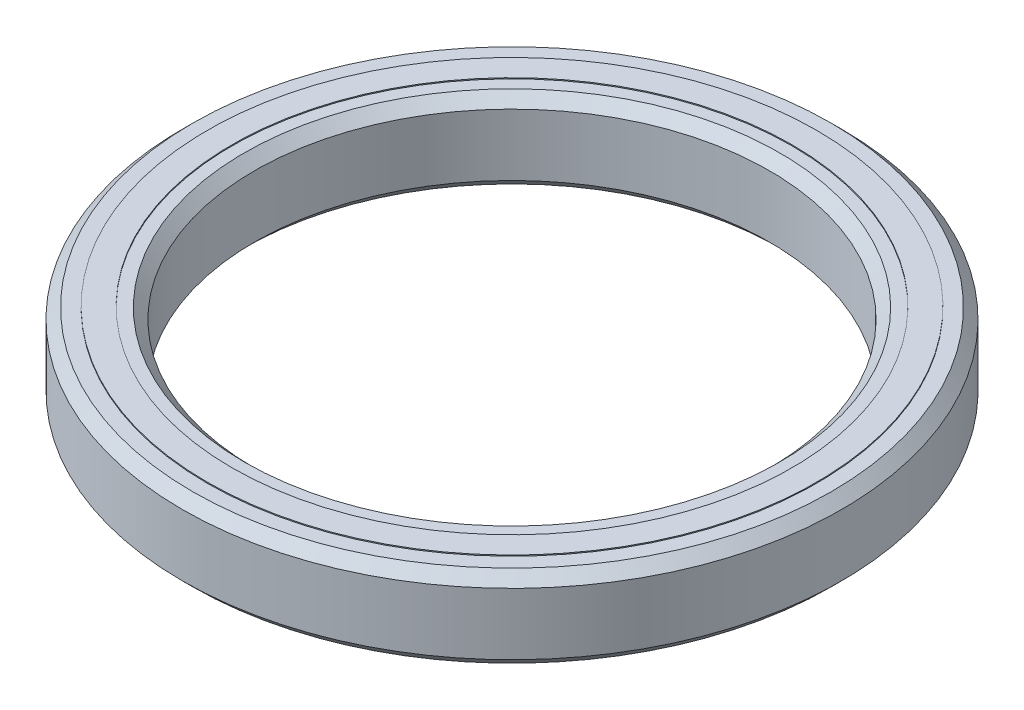
from build123d import *

# Parameters (mm, degrees)
CROQUIS1_R              = 16
CROQUIS1_R_2            = 12.5
SALIENTE_EXTRUIR1_DEPTH = 2
CHAFL_N1_SIZE           = 0.5
CROQUIS2_R              = 14.793460403
CROQUIS2_R_2            = 13.590473759
SALIENTE_EXTRUIR2_DEPTH = 2.05


with BuildPart() as part:
    # Croquis1 → Saliente-Extruir1 (new, symmetric)
    with BuildSketch(Plane(origin=(0, 0, 0), x_dir=(1, 0, 0), z_dir=(0, 1, 0))):
        with Locations(Location((0, 0, 0), (0, 0, 270))):
            Circle(CROQUIS1_R)
        with Locations(Location((0, 0, 0), (0, 0, 270))):
            Circle(CROQUIS1_R_2, mode=Mode.SUBTRACT)
    extrude(amount=SALIENTE_EXTRUIR1_DEPTH, both=True)

    # Chaflán1
    chafl_n1_edges = [part.edges().sort_by_distance(p)[0] for p in [
        (0, -2, -16),
        (0, 2, -16),
        (0, -2, -12.5),
        (0, 2, -12.5),
    ]]
    chamfer(chafl_n1_edges, length=CHAFL_N1_SIZE)

    # Croquis2 → Saliente-Extruir2 (add, symmetric)
    with BuildSketch(Plane(origin=(0, 0, 0), x_dir=(1, 0, 0), z_dir=(0, 1, 0))):
        with Locations(Location((0, 0, 0), (0, 0, 270))):
            Circle(CROQUIS2_R)
        with Locations(Location((0, 0, 0), (0, 0, 270))):
            Circle(CROQUIS2_R_2, mode=Mode.SUBTRACT)
    extrude(amount=SALIENTE_EXTRUIR2_DEPTH, both=True)


solid = part.part
